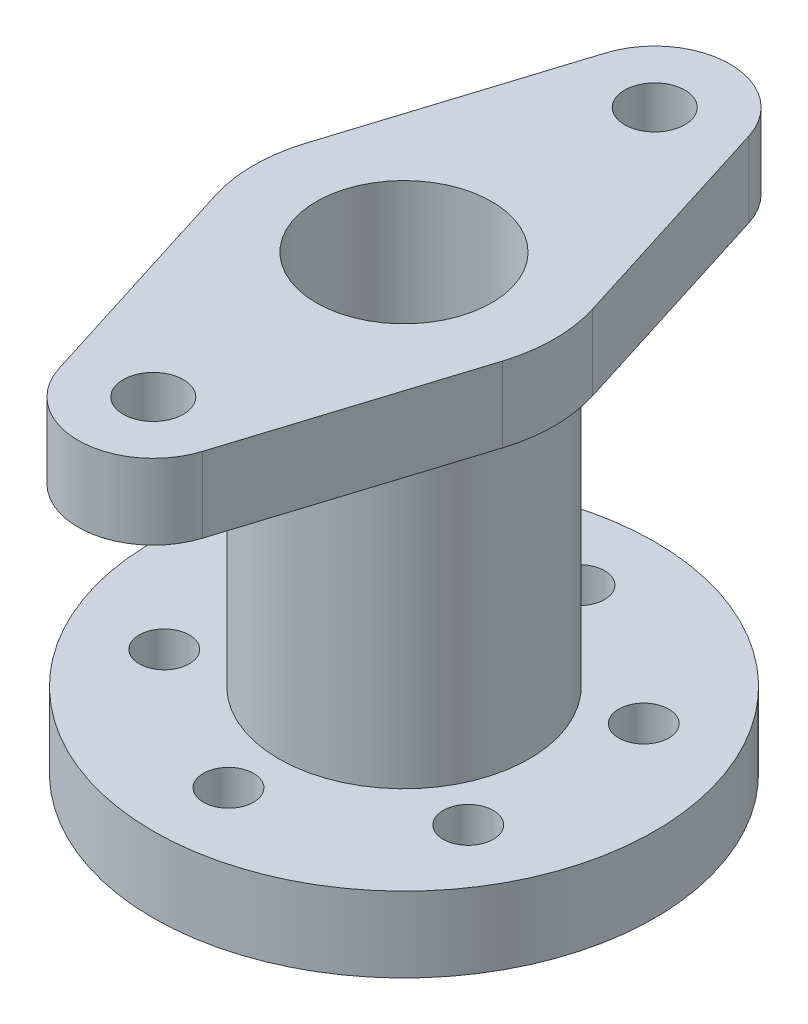
from build123d import *

# Parameters (mm, degrees)
SKETCH1_R           = 50
BOSS_EXTRUDE1_DEPTH = 15
SKETCH2_R           = 5
CUT_EXTRUDE1_DEPTH  = 73.284161474
SKETCH3_R           = 25
SKETCH3_R_2         = 13
BOSS_EXTRUDE2_DEPTH = 60
SKETCH6_R           = 6
SKETCH6_R_2         = 17.5
BOSS_EXTRUDE3_DEPTH = 15
CUT_EXTRUDE2_START  = -30
SKETCH7_R           = 17.5
CUT_EXTRUDE2_DEPTH  = 30


with BuildPart() as part:
    # Sketch1 → Boss-Extrude1 (new body)
    with BuildSketch(Plane(origin=(0, 0, 0), x_dir=(1, 0, 0), z_dir=(0, 1, 0))):
        Circle(SKETCH1_R)
    extrude(amount=BOSS_EXTRUDE1_DEPTH)

    # Sketch2 → Cut-Extrude1 (cut, through all)
    with BuildSketch(Plane(origin=(0, 15, 0), x_dir=(1, 0, 0), z_dir=(0, 1, 0))):
        with Locations((0, 35)):
            Circle(SKETCH2_R)
        with Locations((30.310889132, 17.5)):
            Circle(SKETCH2_R)
        with Locations((30.310889132, -17.5)):
            Circle(SKETCH2_R)
        with Locations((0, -35)):
            Circle(SKETCH2_R)
        with Locations((-30.310889132, -17.5)):
            Circle(SKETCH2_R)
        with Locations((-30.310889132, 17.5)):
            Circle(SKETCH2_R)
    extrude(amount=-CUT_EXTRUDE1_DEPTH, mode=Mode.SUBTRACT)

    # Sketch3 → Boss-Extrude2 (add)
    with BuildSketch(Plane(origin=(0, 15, 0), x_dir=(1, 0, 0), z_dir=(0, 1, 0))):
        Circle(SKETCH3_R)
        Circle(SKETCH3_R_2, mode=Mode.SUBTRACT)
    extrude(amount=BOSS_EXTRUDE2_DEPTH)

    # Sketch6 → Boss-Extrude3 (add)
    with BuildSketch(Plane(origin=(0, 75, 0), x_dir=(1, 0, 0), z_dir=(0, 1, 0))):
        with BuildLine():
            Line((14.309088021, 54.5), (28.618176043, 9))
            ThreePointArc((28.618176043, 9), (30, 0), (28.618176043, -9))
            Line((28.618176043, -9), (14.309088021, -54.5))
            ThreePointArc((14.309088021, -54.5), (0, -65), (-14.309088021, -54.5))
            Line((-14.309088021, -54.5), (-28.618176043, -9))
            ThreePointArc((-28.618176043, -9), (-30, 0), (-28.618176043, 9))
            Line((-28.618176043, 9), (-14.309088021, 54.5))
            ThreePointArc((-14.309088021, 54.5), (0, 65), (14.309088021, 54.5))
        make_face()
        with Locations((0, -50)):
            Circle(SKETCH6_R, mode=Mode.SUBTRACT)
        with Locations((0, 50)):
            Circle(SKETCH6_R, mode=Mode.SUBTRACT)
        Circle(SKETCH6_R_2, mode=Mode.SUBTRACT)
    extrude(amount=BOSS_EXTRUDE3_DEPTH)

    # Sketch7 → Cut-Extrude2 (cut)
    with BuildSketch(Plane(origin=(0, 90, 0), x_dir=(1, 0, 0), z_dir=(0, 1, 0)).offset(CUT_EXTRUDE2_START)):
        Circle(SKETCH7_R)
    extrude(amount=CUT_EXTRUDE2_DEPTH, mode=Mode.SUBTRACT)


solid = part.part
